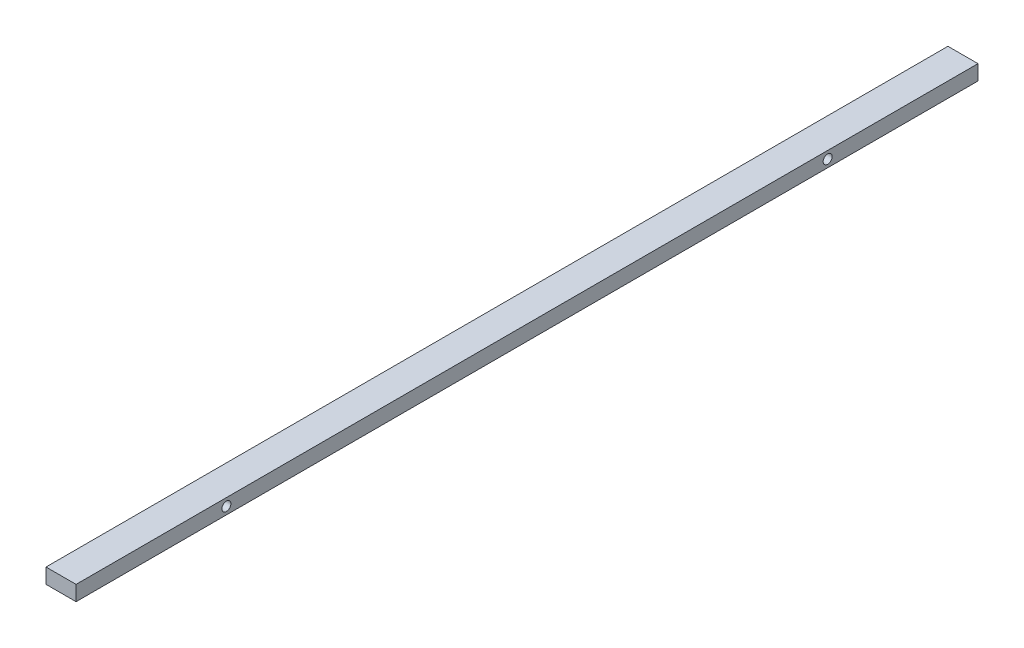
from build123d import *

# Parameters (mm, degrees)
SKETCH1_W               = 10
SKETCH1_H               = 5
BOSS_EXTRUDE1_DEPTH     = 300
CUT_EXTRUDE2_DEPTH      = 301.20217644
CUT_EXTRUDE2_DEPTH_BACK = 301.20217644
SKETCH3_R               = 1.5


with BuildPart() as part:
    # Sketch1 → Boss-Extrude1 (new body)
    with BuildSketch(Plane.XY):
        with Locations((0.232067511, -2.120253165)):
            Rectangle(SKETCH1_W, SKETCH1_H)
    extrude(amount=BOSS_EXTRUDE1_DEPTH)

    # Sketch3 → Cut-Extrude2 (cut, two sides: drawn at the far end of the back side and taken through both)
    with BuildSketch(Plane.ZY.offset(4.767932489).offset(-CUT_EXTRUDE2_DEPTH_BACK)):
        with Locations(Location((250, -2.120253165, 0), (0, 0, 270))):
            Circle(SKETCH3_R)
        with Locations(Location((50, -2.120253165, 0), (0, 0, 270))):
            Circle(SKETCH3_R)
    extrude(amount=CUT_EXTRUDE2_DEPTH + CUT_EXTRUDE2_DEPTH_BACK, mode=Mode.SUBTRACT)


solid = part.part
